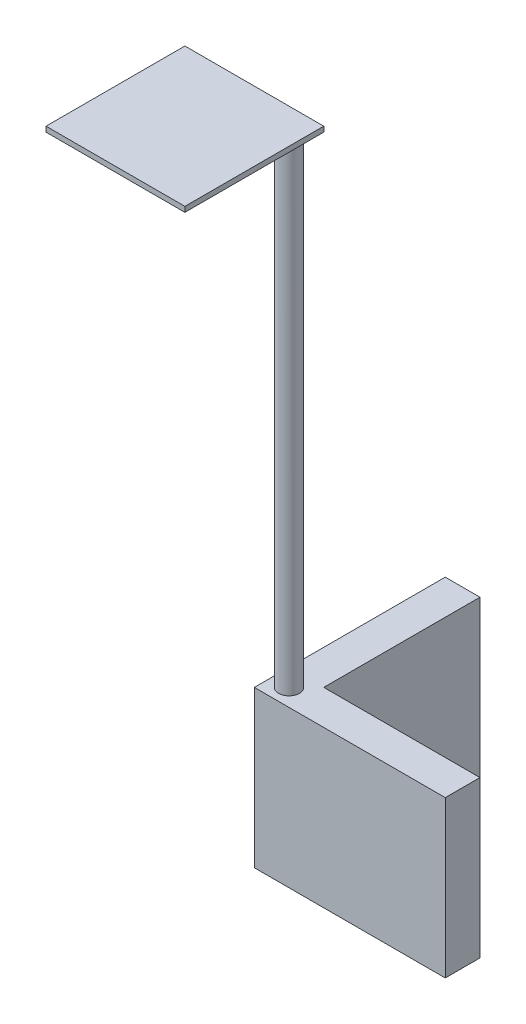
from build123d import *

# Parameters (mm, degrees)
ESQUISSE1_W        = 90
ESQUISSE1_H        = 90
BOSS_EXTRU_1_DEPTH = 20
ESQUISSE5_W        = 110
ESQUISSE5_H        = 90
BOSS_EXTRU_5_DEPTH = 20
ESQUISSE2_R        = 6
BOSS_EXTRU_2_DEPTH = 277
ESQUISSE3_W        = 80
ESQUISSE3_H        = 80
BOSS_EXTRU_3_DEPTH = 2.9
ESQUISSE4_W        = 80
ESQUISSE4_H        = 80
BOSS_EXTRU_4_DEPTH = 0.1


with BuildPart() as part:
    # Esquisse1 → Boss.-Extru.1 (new body)
    with BuildSketch(Plane(origin=(0, 0, 0), x_dir=(0, 0, -1), z_dir=(1, 0, 0))):
        with Locations((30.929303344, -12.964038863)):
            Rectangle(ESQUISSE1_W, ESQUISSE1_H)
    extrude(amount=BOSS_EXTRU_1_DEPTH)

    # Esquisse5 → Boss.-Extru.5 (add)
    with BuildSketch(Plane.XY.offset(14.070696656)):
        with Locations((55, -12.964038863)):
            Rectangle(ESQUISSE5_W, ESQUISSE5_H)
    extrude(amount=BOSS_EXTRU_5_DEPTH)

    # Esquisse2 → Boss.-Extru.2 (add)
    with BuildSketch(Plane(origin=(0, 32.035961137, 0), x_dir=(1, 0, 0), z_dir=(0, 1, 0))):
        with Locations(Location((10, -24.070696656, 0), (0, 0, 90))):
            Circle(ESQUISSE2_R)
    extrude(amount=BOSS_EXTRU_2_DEPTH)

    # Esquisse3 → Boss.-Extru.3 (add)
    with BuildSketch(Plane(origin=(0, 309.035961137, 0), x_dir=(1, 0, 0), z_dir=(0, 1, 0))):
        with Locations((-20, -54.070696656)):
            Rectangle(ESQUISSE3_W, ESQUISSE3_H)
    extrude(amount=BOSS_EXTRU_3_DEPTH)

    # Esquisse4 → Boss.-Extru.4 (add)
    with BuildSketch(Plane(origin=(0, 311.935961137, 0), x_dir=(1, 0, 0), z_dir=(0, 1, 0))):
        with Locations((-20, -54.070696656)):
            Rectangle(ESQUISSE4_W, ESQUISSE4_H)
    extrude(amount=BOSS_EXTRU_4_DEPTH)


solid = part.part
